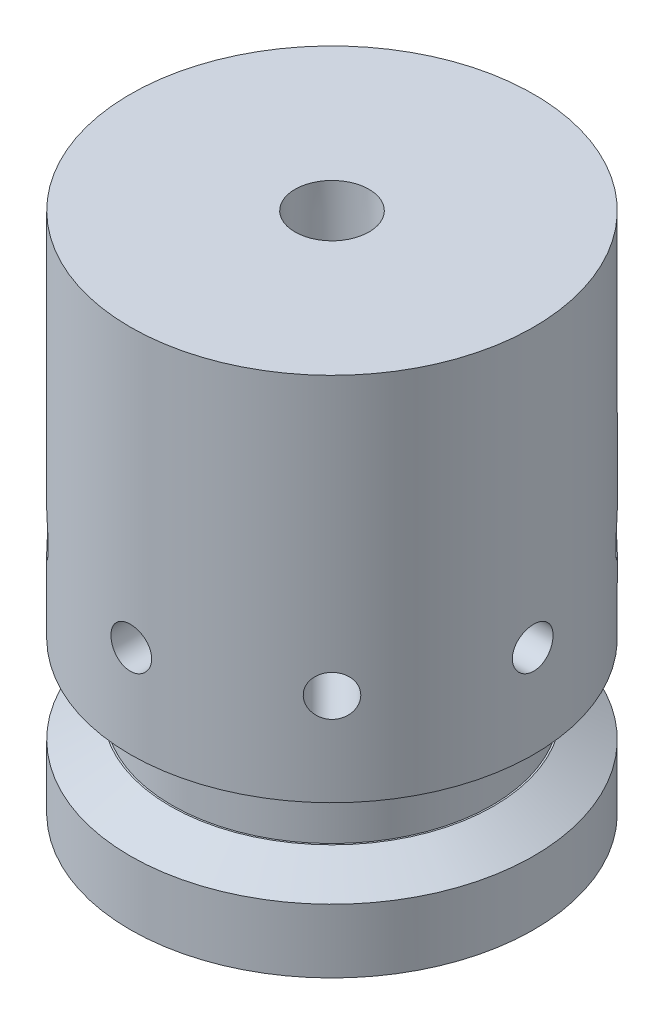
from build123d import *

# Parameters (mm, degrees)
SKETCH3_R               = 1.1
CUT_EXTRUDE1_DEPTH      = 7
CIRPATTERN1_COUNT       = 8
CHAMFER2_SIZE           = 1.25
CHAMFER2_SIZE2          = 2.165063509
CUT_EXTRUDE2_DEPTH      = 3
CUT_EXTRUDE2_DEPTH_BACK = 1
FILLET1_R               = 0.5


with BuildPart() as part:
    # Sketch2 → Revolve1 (revolve)
    with BuildSketch(Plane.XY, mode=Mode.PRIVATE) as revolve1_sk:
        Polygon((-1.7, 0), (-1.7, 4), (-2, 19), (-10.9, 19), (-10.9, 4), (-10.9, -1), (-8.65, -1), (-8.65, -4.5), (-10.9, -4.5), (-10.9, -9.2), align=None)
    revolve(revolve1_sk.sketch.rotate(Axis((0, 19.141519074, 0), (0, -1, 0)), 270), axis=Axis((0, 19.141519074, 0), (0, -1, 0)))

    # Sketch3 → Cut-Extrude1 (cut)
    with BuildSketch(Plane.ZY.offset(10.9)):
        with Locations((0, 4)):
            Circle(SKETCH3_R)
    cut_extrude1 = extrude(amount=-CUT_EXTRUDE1_DEPTH, mode=Mode.SUBTRACT)

    # CirPattern1: Cut-Extrude1 ×8 about axis
    cirpattern1_axis = Axis((0, 0, 0), (0, 1, 0))
    for i in range(1, CIRPATTERN1_COUNT):
        add(cut_extrude1.rotate(cirpattern1_axis, i * 360 / CIRPATTERN1_COUNT), mode=Mode.SUBTRACT)

    # Chamfer2
    chamfer2_edges = [part.edges().sort_by_distance(p)[0] for p in [
        (0, -4.5, -10.9),
    ]]
    chamfer2_side = [part.faces().sort_by_distance(p)[0] for p in [
        (0, -6.85, -10.9),
    ]]
    chamfer(chamfer2_edges, length=CHAMFER2_SIZE, length2=CHAMFER2_SIZE2, reference=chamfer2_side[0])

    # Sketch4 → Cut-Extrude2 (cut, two sides: drawn at the far end of the back side and taken through both)
    with BuildSketch(Plane(origin=(0, 0, 0), x_dir=(-1, 0, 0), z_dir=(0, -1, 0)).offset(-CUT_EXTRUDE2_DEPTH_BACK)):
        Polygon((3.983716857, 0), (1.991858429, 3.45), (-1.991858429, 3.45), (-3.983716857, 0), (-1.991858429, -3.45), (1.991858429, -3.45), align=None)
    extrude(amount=CUT_EXTRUDE2_DEPTH + CUT_EXTRUDE2_DEPTH_BACK, mode=Mode.SUBTRACT)

    # Fillet1
    fillet1_edges = [part.edges().sort_by_distance(p)[0] for p in [
        (-1.026403404, -1.89944495, 3.45),
        (2.987787643, -1.75, 1.725),
        (2.987787643, -1.75, -1.725),
        (0, -1.75, -3.45),
        (-2.987787643, -1.75, -1.725),
        (-2.987787643, -1.75, 1.725),
    ]]
    fillet(fillet1_edges, radius=FILLET1_R)


solid = part.part
